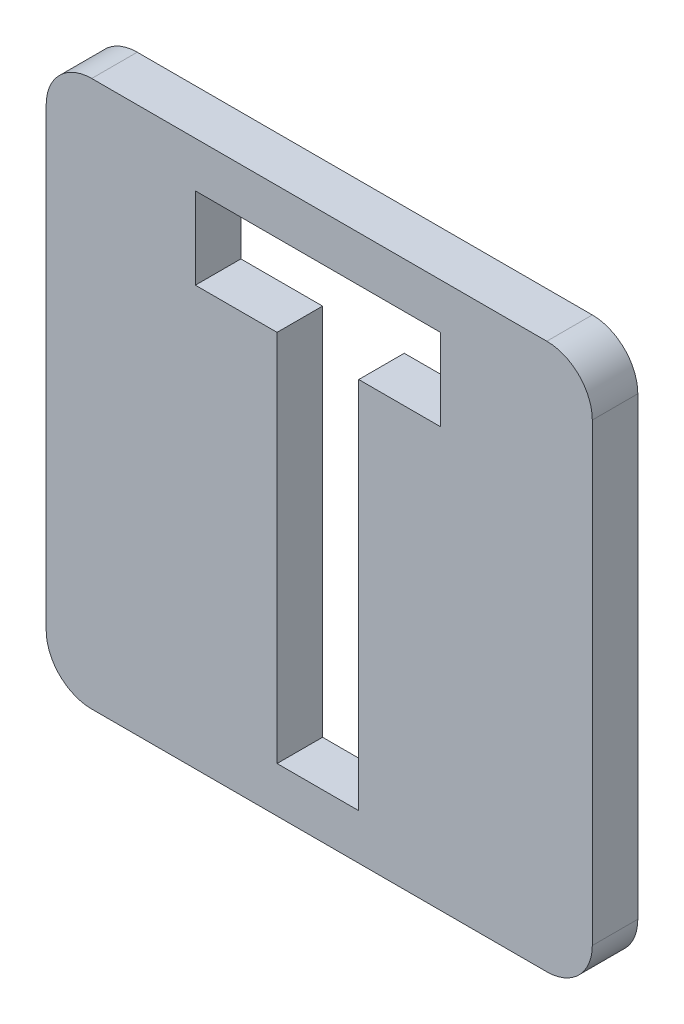
from build123d import *

# Parameters (mm, degrees)
BOSS_EXTRUDE1_DEPTH = 10
CUT_EXTRUDE33_DEPTH = 10


with BuildPart() as part:
    # Sketch1 → Boss-Extrude1 (new body)
    with BuildSketch(Plane.XY):
        with BuildLine():
            Line((-50, 60), (50, 60))
            ThreePointArc((50, 60), (57.071067812, 57.071067812), (60, 50))
            Line((60, 50), (60, -50))
            ThreePointArc((60, -50), (57.071067812, -57.071067812), (50, -60))
            Line((50, -60), (-50, -60))
            ThreePointArc((-50, -60), (-57.071067812, -57.071067812), (-60, -50))
            Line((-60, -50), (-60, 50))
            ThreePointArc((-60, 50), (-57.071067812, 57.071067812), (-50, 60))
        make_face()
    extrude(amount=BOSS_EXTRUDE1_DEPTH)

    # Sketch2 → Cut-Extrude33 (cut)
    with BuildSketch(Plane.XY.offset(10)):
        Polygon((-27.217948718, 50), (26.628205128, 50), (26.628205128, 32.051282051), (8.679487179, 32.051282051), (8.679487179, -50), (-9.269230769, -50), (-9.269230769, 32.051282051), (-27.217948718, 32.051282051), align=None)
    extrude(amount=-CUT_EXTRUDE33_DEPTH, mode=Mode.SUBTRACT)


solid = part.part
